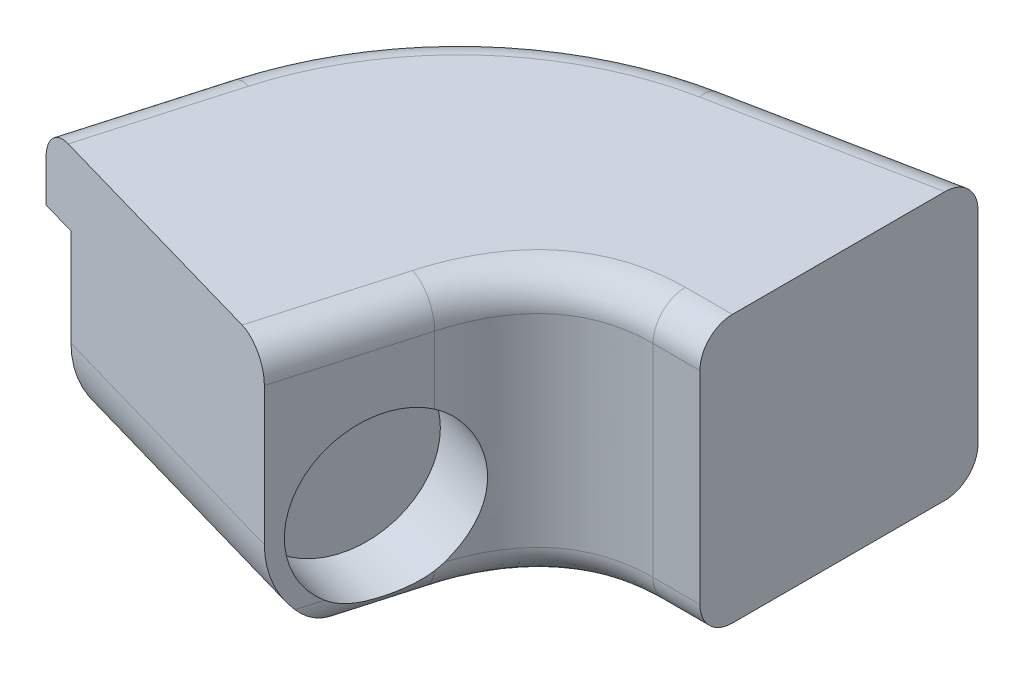
from build123d import *

# Parameters (mm, degrees)
EXTRUDE_1_DEPTH          = 10.5
EXTRUDE_1_DEPTH_BACK     = 6
FILLET_1_R               = 2
CUT_EXTRUDE_1_DEPTH      = 51.301816014
CUT_EXTRUDE_1_DEPTH_BACK = 51.301816014
SKETCH_2_R               = 5
CUT_EXTRUDE_2_DEPTH      = 2.25
EXTRUDE_3_DEPTH          = 9.401473572


with BuildPart() as part:
    # Эскиз1 → Бобышка-Вытянуть1 (new, two sides: drawn at the far end of the back side and taken through both)
    with BuildSketch(Plane(origin=(0, 0, 0), x_dir=(1, 0, 0), z_dir=(0, 1, 0)).offset(-EXTRUDE_1_DEPTH_BACK)):
        with BuildLine():
            Line((-26.485281374, 38.5), (-26.485281374, 55.65945007))
            Line((-26.485281374, 55.65945007), (-39.508260541, 53.069018453))
            ThreePointArc((-39.508260541, 53.069018453), (-49.589786713, 47.94606891), (-55.52997461, 38.323389984))
            Line((-55.52997461, 38.323389984), (-58.010710812, 29.67203472))
            Line((-58.010710812, 29.67203472), (-55.847871996, 29.05185067))
            Line((-55.847871996, 29.05185067), (-52.002825213, 27.949301246))
            Line((-52.002825213, 27.949301246), (-48.695176943, 39.484441598))
            Line((-48.695176943, 39.484441598), (-39.657900512, 36.893044281))
            Line((-39.657900512, 36.893044281), (-42.965548782, 25.35790393))
            Line((-42.965548782, 25.35790393), (-39.120501998, 24.255354507))
            Line((-39.120501998, 24.255354507), (-36.777584474, 32.426078922))
            add(Edge.make_bspline(
                [(-36.777584474, 32.426078922), (-35.035915631, 38.5), (-29.380741372, 38.5)],
                knots=[0, 0, 0, 1, 1, 1], degree=2))
            Line((-29.380741372, 38.5), (-26.485281374, 38.5))
        make_face()
    extrude(amount=EXTRUDE_1_DEPTH + EXTRUDE_1_DEPTH_BACK)

    # Скругление1
    fillet_1_edges = [part.edges().sort_by_distance(p)[0] for p in [
        (-34.198352133, 10.5, -36.862455815),
        (-27.933011373, 10.5, -38.5),
        (-32.996770958, 10.5, -54.364234261),
        (-49.589786713, 10.5, -47.94606891),
        (-37.949043236, -6, -28.340716715),
        (-56.770342711, -6, -33.997712352),
        (-56.770342711, 10.5, -33.997712352),
        (-49.589786713, -6, -47.94606891),
        (-32.996770958, -6, -54.364234261),
        (-27.933011373, -6, -38.5),
        (-34.198352133, -6, -36.862455815),
        (-37.949043236, 10.5, -28.340716715),
    ]]
    fillet(fillet_1_edges, radius=FILLET_1_R)

    # Эскиз2 → Вырез-Вытянуть1 (cut, two sides: drawn at the far end of the back side and taken through both)
    with BuildSketch(Plane(origin=(-55.457297641, 0, -15.902124205), x_dir=(-0.27563735581600457, 0, 0.9612616959386041), z_dir=(-0.9612616959386041, 0, -0.27563735581600457)).offset(-CUT_EXTRUDE_1_DEPTH_BACK)):
        with BuildLine():
            Line((-18.53267148, -6), (-12.53267148, -6))
            Line((-12.53267148, -6), (-12.53267148, 0))
            ThreePointArc((-12.53267148, 0), (-14.290030793, -4.242640687), (-18.53267148, -6))
        make_face()
        with Locations((-18.53267148, 0)):
            Circle(SKETCH_2_R)
    extrude(amount=CUT_EXTRUDE_1_DEPTH + CUT_EXTRUDE_1_DEPTH_BACK, mode=Mode.SUBTRACT)

    # Эскиз4 → Вырез-Вытянуть2 (cut)
    with BuildSketch(Plane(origin=(-61.46518324, 0, -17.624857679), x_dir=(-0.2756373558160068, 0, 0.9612616959386036), z_dir=(-0.9612616959386036, 0, -0.2756373558160068))):
        with BuildLine():
            Line((-16.03267148, 6), (-12.53267148, 6))
            Line((-12.53267148, 6), (-12.53267148, 2.5))
            Line((-12.53267148, 2.5), (-12.53267148, -6))
            Line((-12.53267148, -6), (-21.032671479, -6))
            Line((-21.032671479, -6), (-24.53267148, -6))
            Line((-24.53267148, -6), (-24.53267148, -2.499999999))
            ThreePointArc((-24.53267148, -2.499999999), (-23.128865557, 4.596194078), (-16.03267148, 6))
        make_face()
    extrude(amount=-CUT_EXTRUDE_2_DEPTH, mode=Mode.SUBTRACT)

    # Эскиз5 → Бобышка-Вытянуть3 (add)
    with BuildSketch(Plane(origin=(-46.42002121, 0, -13.310726889), x_dir=(-0.2756373558157037, 0, 0.9612616959386904), z_dir=(-0.9612616959386904, 0, -0.2756373558157037))):
        with BuildLine():
            Line((-24.53267148, 10.5), (-24.53267148, -6))
            Line((-24.53267148, -6), (-18.53267148, -6))
            ThreePointArc((-18.53267148, -6), (-14.290030793, -4.242640687), (-12.53267148, 0))
            Line((-12.53267148, 0), (-12.53267148, 10.5))
            Line((-12.53267148, 10.5), (-24.53267148, 10.5))
        make_face()
    extrude(amount=EXTRUDE_3_DEPTH)


solid = part.part
